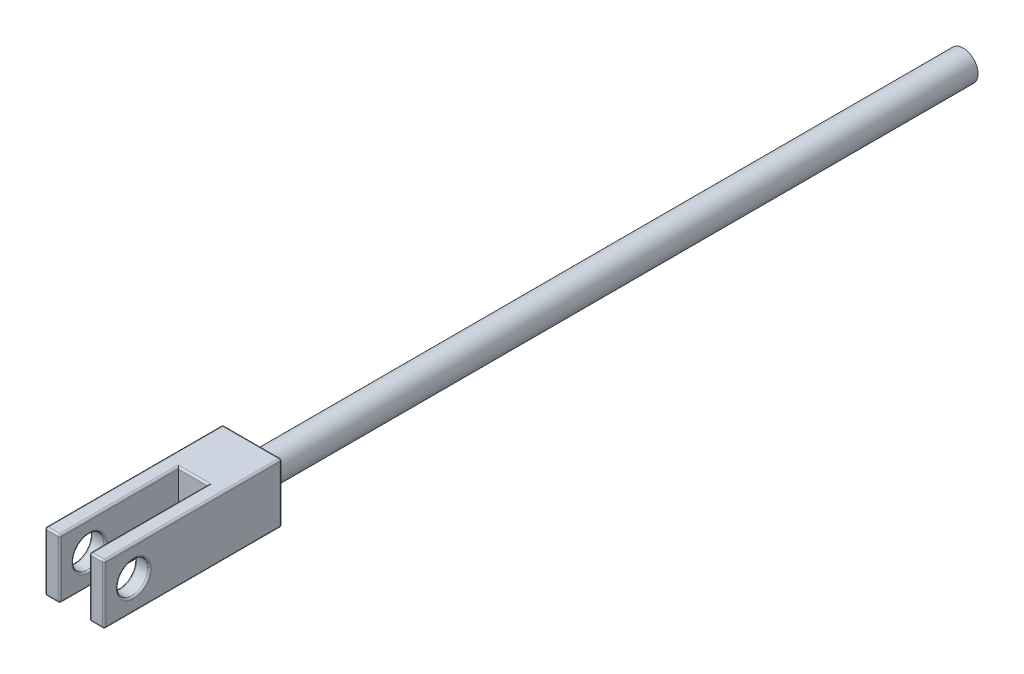
from build123d import *

# Parameters (mm, degrees)
SKETCH1_R               = 3.175
EXTRUDE1_DEPTH          = 152.4
SKETCH2_W               = 12.7
SKETCH2_H               = 12.7
EXTRUDE2_DEPTH          = 38.1
SKETCH3_W               = 6.35
SKETCH3_H               = 25.4
EXTRUDE3_DEPTH          = 192.028433747
F_1_4_CLEARANCE_HOLE1_D = 6.7564
FILLET1_R               = 0.381


with BuildPart() as part:
    # Sketch1 → Extrude1 (new body)
    with BuildSketch(Plane.XY):
        with Locations(Location((0, 0, 0), (0, 0, 180))):
            Circle(SKETCH1_R)
    extrude(amount=EXTRUDE1_DEPTH)

    # Sketch2 → Extrude2 (add)
    with BuildSketch(Plane.XY.offset(152.4)):
        Rectangle(SKETCH2_W, SKETCH2_H)
    extrude(amount=EXTRUDE2_DEPTH)

    # Sketch3 → Extrude3 (cut, through all)
    with BuildSketch(Plane(origin=(0, 6.35, 0), x_dir=(1, 0, 0), z_dir=(0, 1, 0))):
        with Locations((0, -177.8)):
            Rectangle(SKETCH3_W, SKETCH3_H)
    extrude(amount=-EXTRUDE3_DEPTH, mode=Mode.SUBTRACT)

    # 1/4 Clearance Hole1 (through all)
    with Locations(Plane(origin=(6.35, 0, 0), x_dir=(0, 0, -1), z_dir=(1, 0, 0))):
        with Locations((-184.15, 0)):
            Hole(F_1_4_CLEARANCE_HOLE1_D / 2)

    # Fillet1
    fillet1_edges = [part.edges().sort_by_distance(p)[0] for p in [
        (-4.7625, 6.35, 190.5),
        (4.7625, -6.35, 190.5),
        (-3.175, -6.35, 177.8),
        (-3.175, 0, 190.5),
        (0, -6.35, 165.1),
        (3.175, -6.35, 177.8),
        (3.175, 0, 190.5),
        (-3.175, 6.35, 177.8),
        (3.175, 6.35, 177.8),
        (0, 6.35, 165.1),
        (-6.35, 0, 180.7718),
        (-3.175, 0, 180.7718),
        (3.175, 0, 180.7718),
        (6.35, 0, 180.7718),
        (3.175, 0, 152.4),
        (6.35, 0, 152.4),
        (6.35, -6.35, 171.45),
        (0, 6.35, 152.4),
        (6.35, 6.35, 171.45),
        (-6.35, 0, 152.4),
        (-6.35, 6.35, 171.45),
        (0, -6.35, 152.4),
        (-6.35, -6.35, 171.45),
        (6.35, 0, 190.5),
        (4.7625, 6.35, 190.5),
        (-6.35, 0, 190.5),
        (-4.7625, -6.35, 190.5),
    ]]
    fillet(fillet1_edges, radius=FILLET1_R)


solid = part.part
